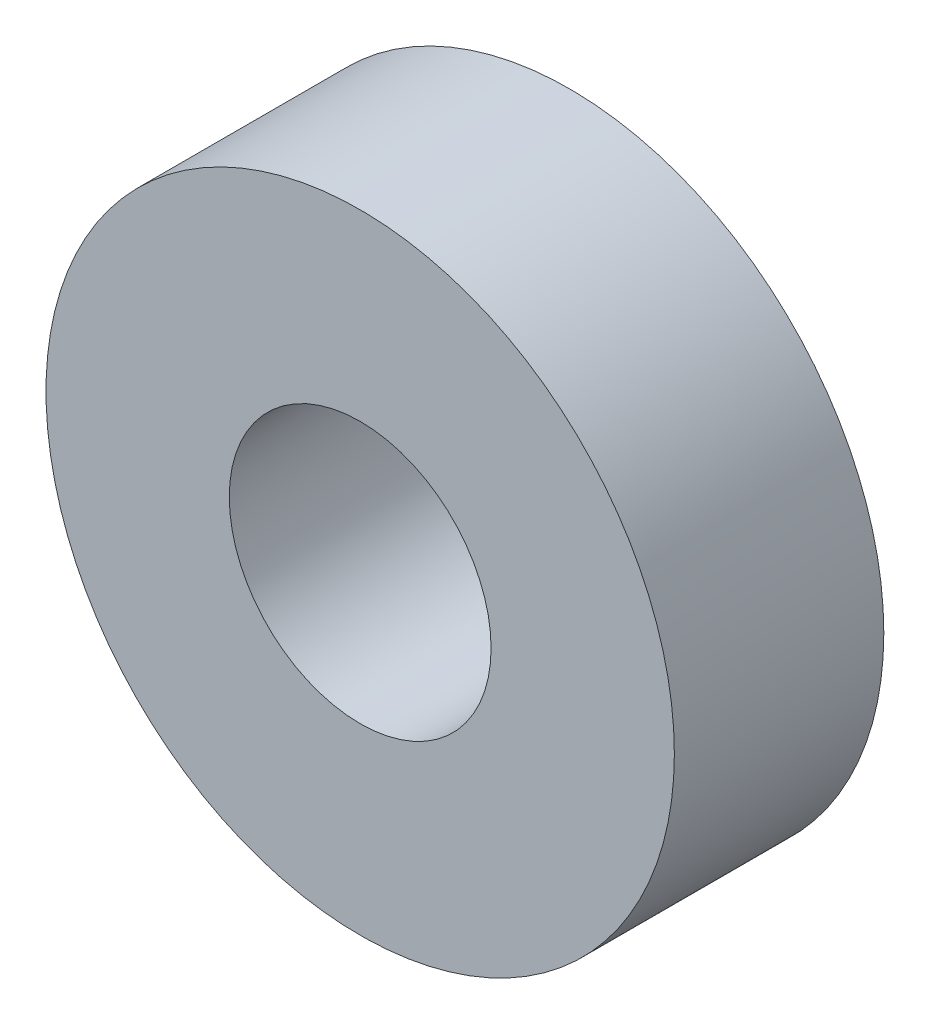
from build123d import *

# Parameters (mm, degrees)
SKETCH_1_R      = 6
SKETCH_1_R_2    = 2.5
EXTRUDE_1_DEPTH = 2


with BuildPart() as part:
    # 草图1 → 凸台-拉伸1 (new, symmetric)
    with BuildSketch(Plane.XY):
        Circle(SKETCH_1_R)
        Circle(SKETCH_1_R_2, mode=Mode.SUBTRACT)
    extrude(amount=EXTRUDE_1_DEPTH, both=True)


solid = part.part
